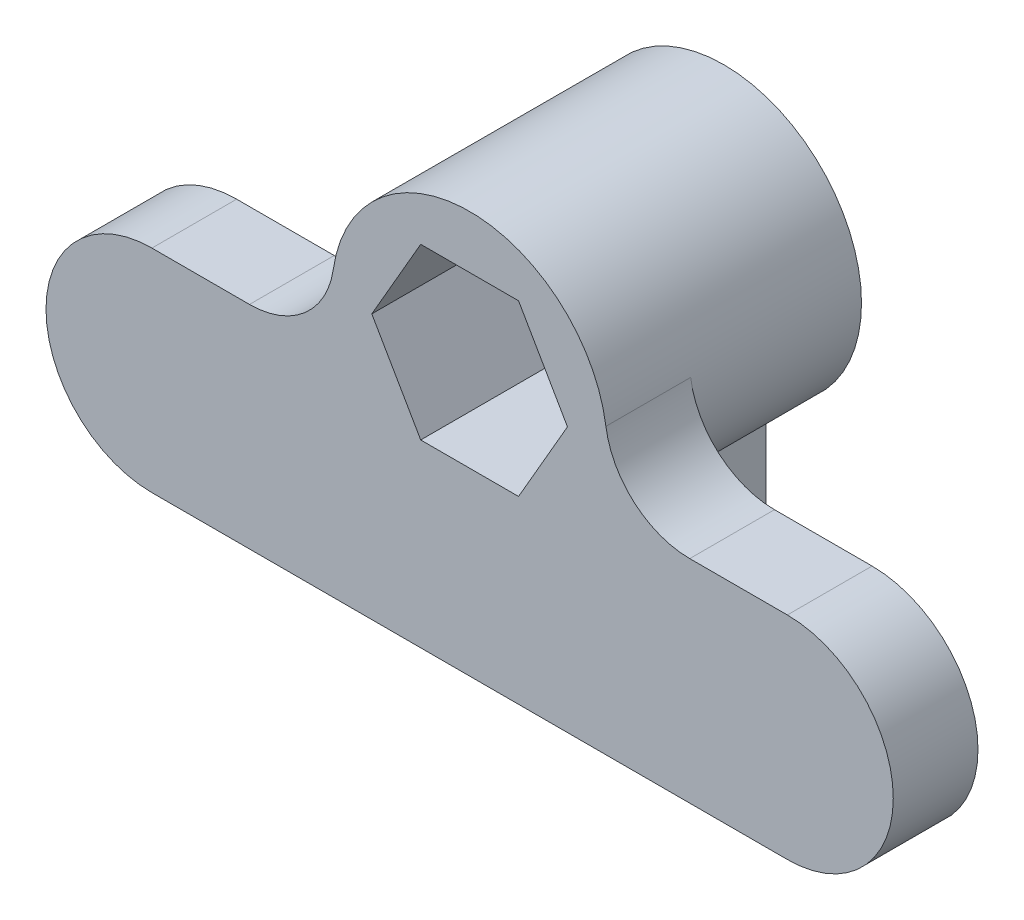
from build123d import *

# Parameters (mm, degrees)
SKETCH1_R           = 1.25
BOSS_EXTRUDE1_DEPTH = 2
BOSS_EXTRUDE2_DEPTH = 4
FILLET1_R           = 2
SKETCH3_R           = 1.25
BOSS_EXTRUDE3_DEPTH = 4
BOSS_EXTRUDE4_DEPTH = 2
CUT_EXTRUDE1_DEPTH  = 4


with BuildPart() as part:
    # Sketch1 → Boss-Extrude1 (new body)
    with BuildSketch(Plane.XY):
        with BuildLine():
            Line((-7.5, -1.25), (-3, -1.25))
            ThreePointArc((-3, -1.25), (0, 3.25), (3, -1.25))
            Line((3, -1.25), (7.5, -1.25))
            ThreePointArc((7.5, -1.25), (10, -3.75), (7.5, -6.25))
            Line((7.5, -6.25), (-7.5, -6.25))
            ThreePointArc((-7.5, -6.25), (-10, -3.75), (-7.5, -1.25))
        make_face()
        Circle(SKETCH1_R, mode=Mode.SUBTRACT)
    extrude(amount=BOSS_EXTRUDE1_DEPTH)

    # Sketch2 → Boss-Extrude2 (add)
    with BuildSketch(Plane.XY.offset(2)):
        with BuildLine():
            Line((-8, -6.199489743), (-8, -1.300510257))
            ThreePointArc((-8, -1.300510257), (-10, -3.75), (-8, -6.199489743))
        make_face()
        with BuildLine():
            ThreePointArc((3, -1.703672504), (0, -3.45), (-3, -1.703672504))
            Line((-3, -1.703672504), (-3, -6.25))
            Line((-3, -6.25), (3, -6.25))
            Line((3, -6.25), (3, -1.703672504))
        make_face()
        with BuildLine():
            ThreePointArc((8, -6.199489743), (10, -3.75), (8, -1.300510257))
            Line((8, -1.300510257), (8, -6.199489743))
        make_face()
    extrude(amount=BOSS_EXTRUDE2_DEPTH)

    # Fillet1
    fillet1_edges = [part.edges().sort_by_distance(p)[0] for p in [
        (3, -1.25, 1),
        (-3, -1.25, 1),
    ]]
    fillet(fillet1_edges, radius=FILLET1_R)


with BuildPart() as body_2:
    # Sketch3 → Boss-Extrude3 (new body)
    with BuildSketch(Plane.XY.offset(2)):
        with BuildLine():
            Line((-1, -3.092329219), (-1, -6.25))
            Line((-1, -6.25), (1, -6.25))
            Line((1, -6.25), (1, -3.092329219))
            ThreePointArc((1, -3.092329219), (0, 3.25), (-1, -3.092329219))
        make_face()
        Circle(SKETCH3_R, mode=Mode.SUBTRACT)
    extrude(amount=BOSS_EXTRUDE3_DEPTH)

    # Sketch4 → Boss-Extrude4 (add)
    with BuildSketch(Plane.XY.offset(6)):
        with BuildLine():
            Line((7.5, -1.25), (5.196152423, -1.25))
            ThreePointArc((5.196152423, -1.25), (3.886845081, -0.761857892), (3.216665785, 0.464285714))
            ThreePointArc((3.216665785, 0.464285714), (0, 3.25), (-3.216665785, 0.464285714))
            ThreePointArc((-3.216665785, 0.464285714), (-3.886845081, -0.761857892), (-5.196152423, -1.25))
            Line((-5.196152423, -1.25), (-7.5, -1.25))
            ThreePointArc((-7.5, -1.25), (-10, -3.75), (-7.5, -6.25))
            Line((-7.5, -6.25), (7.5, -6.25))
            ThreePointArc((7.5, -6.25), (10, -3.75), (7.5, -1.25))
        make_face()
    extrude(amount=BOSS_EXTRUDE4_DEPTH)

    # Sketch5 → Cut-Extrude1 (cut)
    with BuildSketch(Plane.XY.offset(8)):
        Polygon((1.154700538, 2), (-1.154700538, 2), (-2.309401077, 0), (-1.154700538, -2), (1.154700538, -2), (2.309401077, 0), align=None)
    extrude(amount=-CUT_EXTRUDE1_DEPTH, mode=Mode.SUBTRACT)


solid = body_2.part
